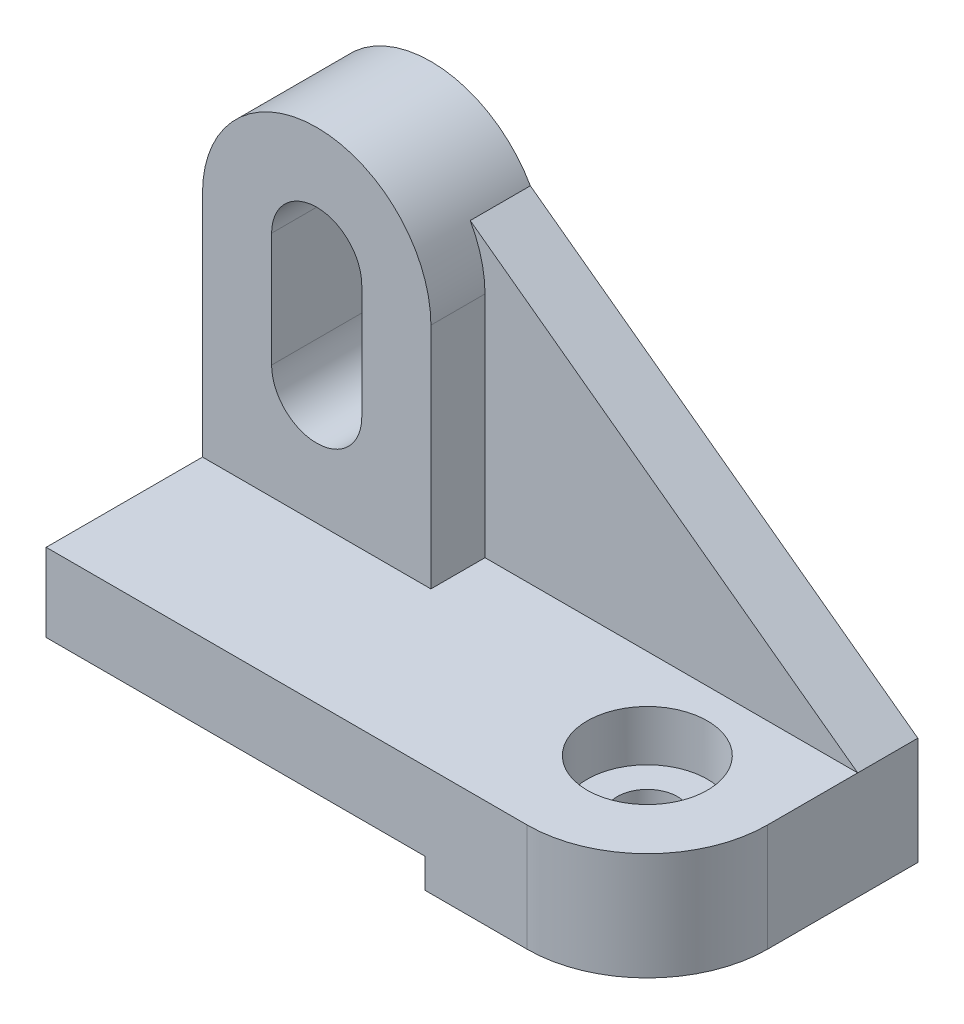
from build123d import *

# Parameters (mm, degrees)
BOSS_EXTRUDE1_DEPTH = 45
FILLET1_R           = 20
BOSS_EXTRUDE2_DEPTH = 19
BOSS_EXTRUDE3_DEPTH = 10
CUT_EXTRUDE2_REACH  = 92.422
SKETCH4_R           = 10
SKETCH4_R_2         = 5
SKETCH4_R_3         = 3
BOSS_EXTRUDE4_START = -9.5
SKETCH7_R           = 10
SKETCH7_R_2         = 5
BOSS_EXTRUDE4_DEPTH = 9.5


with BuildPart() as part:
    # Sketch1 → Boss-Extrude1 (new body)
    with BuildSketch(Plane.XY):
        Polygon((-53.872058339, 0), (-53.872058339, 13), (46.127941661, 13), (46.127941661, -4.908485857), (9.127941661, -4.908485857), (9.127941661, 0), align=None)
    extrude(amount=-BOSS_EXTRUDE1_DEPTH)

    # Fillet1
    fillet1_edges = [part.edges().sort_by_distance(p)[0] for p in [
        (46.127941661, 4.045757072, 0),
    ]]
    fillet(fillet1_edges, radius=FILLET1_R)

    # Sketch2 → Boss-Extrude2 (add)
    with BuildSketch(Plane(origin=(0, 0, -45), x_dir=(-1, 0, 0), z_dir=(0, 0, -1))):
        with BuildLine():
            Line((53.872058339, 13), (53.872058339, 51))
            ThreePointArc((53.872058339, 51), (34.872058339, 70), (15.872058339, 51))
            Line((15.872058339, 51), (15.872058339, 13))
            Line((15.872058339, 13), (53.872058339, 13))
        make_face()
        with BuildLine():
            Line((42.372058339, 51), (42.372058339, 32))
            ThreePointArc((42.372058339, 32), (34.872058339, 24.5), (27.372058339, 32))
            Line((27.372058339, 32), (27.372058339, 51))
            ThreePointArc((27.372058339, 51), (34.872058339, 58.5), (42.372058339, 51))
        make_face(mode=Mode.SUBTRACT)
    extrude(amount=-BOSS_EXTRUDE2_DEPTH)

    # Sketch3 → Boss-Extrude3 (add)
    with BuildSketch(Plane(origin=(0, 0, -45), x_dir=(-1, 0, 0), z_dir=(0, 0, -1))):
        Polygon((-46.127941661, 13), (16.803506509, 13), (18.329411345, 13), (18.329411345, 60.345631624), align=None)
    extrude(amount=-BOSS_EXTRUDE3_DEPTH)

    # Sketch4 → Cut-Extrude2 (cut, up to next)
    with BuildSketch(Plane(origin=(0, 13, 0), x_dir=(1, 0, 0), z_dir=(0, 1, 0)), mode=Mode.PRIVATE) as cut_extrude2_sk1:
        with Locations(Location((26.127941661, 20, 0), (0, 0, 270))):
            Circle(SKETCH4_R)
        with Locations((26.127941661, 20)):
            Circle(SKETCH4_R_2, mode=Mode.SUBTRACT)
    cut_extrude2_tool1 = extrude(cut_extrude2_sk1.sketch, amount=-CUT_EXTRUDE2_REACH, mode=Mode.PRIVATE) & part.part
    # Sketch4 → Cut-Extrude2 (cut, up to next)
    with BuildSketch(Plane(origin=(0, 13, 0), x_dir=(1, 0, 0), z_dir=(0, 1, 0)), mode=Mode.PRIVATE) as cut_extrude2_sk2:
        with Locations((26.127941661, 20)):
            Circle(SKETCH4_R_2)
        with Locations((26.127941661, 20)):
            Circle(SKETCH4_R_3, mode=Mode.SUBTRACT)
    cut_extrude2_tool2 = extrude(cut_extrude2_sk2.sketch, amount=-CUT_EXTRUDE2_REACH, mode=Mode.PRIVATE) & part.part
    # Sketch4 → Cut-Extrude2 (cut, up to next)
    with BuildSketch(Plane(origin=(0, 13, 0), x_dir=(1, 0, 0), z_dir=(0, 1, 0)), mode=Mode.PRIVATE) as cut_extrude2_sk3:
        with Locations((26.127941661, 20)):
            Circle(SKETCH4_R_3)
    cut_extrude2_tool3 = extrude(cut_extrude2_sk3.sketch, amount=-CUT_EXTRUDE2_REACH, mode=Mode.PRIVATE) & part.part
    add(cut_extrude2_tool1.solids().sort_by_distance((26.127942, 13, -29.717157))[0], mode=Mode.SUBTRACT)
    add(cut_extrude2_tool2.solids().sort_by_distance((21.269363, 13, -20))[0], mode=Mode.SUBTRACT)
    add(cut_extrude2_tool3.solids().sort_by_distance((26.127942, 13, -20))[0], mode=Mode.SUBTRACT)

    # Sketch7 → Boss-Extrude4 (add)
    with BuildSketch(Plane.XZ.offset(4.908485857).offset(BOSS_EXTRUDE4_START)):
        with Locations(Location((26.127941661, -20, 0), (0, 0, 90))):
            Circle(SKETCH7_R)
        with Locations((26.127941661, -20)):
            Circle(SKETCH7_R_2, mode=Mode.SUBTRACT)
    extrude(amount=BOSS_EXTRUDE4_DEPTH)


solid = part.part
